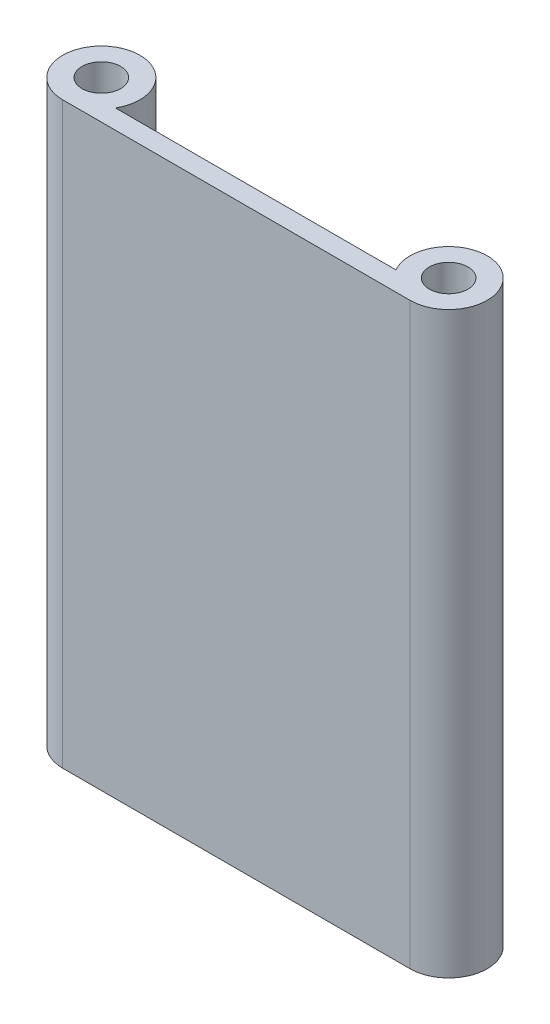
from build123d import *

# Parameters (mm, degrees)
SKETCH1_R           = 3.175
BOSS_EXTRUDE1_DEPTH = 95.25


with BuildPart() as part:
    # Sketch1 → Boss-Extrude1 (new body)
    with BuildSketch(Plane(origin=(0, 0, 0), x_dir=(1, 0, 0), z_dir=(0, 1, 0))):
        with BuildLine():
            Line((-28.575, -1.756521345), (28.575, -1.756521345))
            ThreePointArc((28.575, -1.756521345), (31.75, 10.092739969), (23.075738686, 1.418478655))
            Line((23.075738686, 1.418478655), (-23.075738686, 1.418478655))
            ThreePointArc((-23.075738686, 1.418478655), (-31.75, 10.092739969), (-28.575, -1.756521345))
        make_face()
        with Locations(Location((-28.575, 4.593478655, 0), (0, 0, 270))):
            Circle(SKETCH1_R, mode=Mode.SUBTRACT)
        with Locations(Location((28.575, 4.593478655, 0), (0, 0, 270))):
            Circle(SKETCH1_R, mode=Mode.SUBTRACT)
    extrude(amount=BOSS_EXTRUDE1_DEPTH)


solid = part.part
